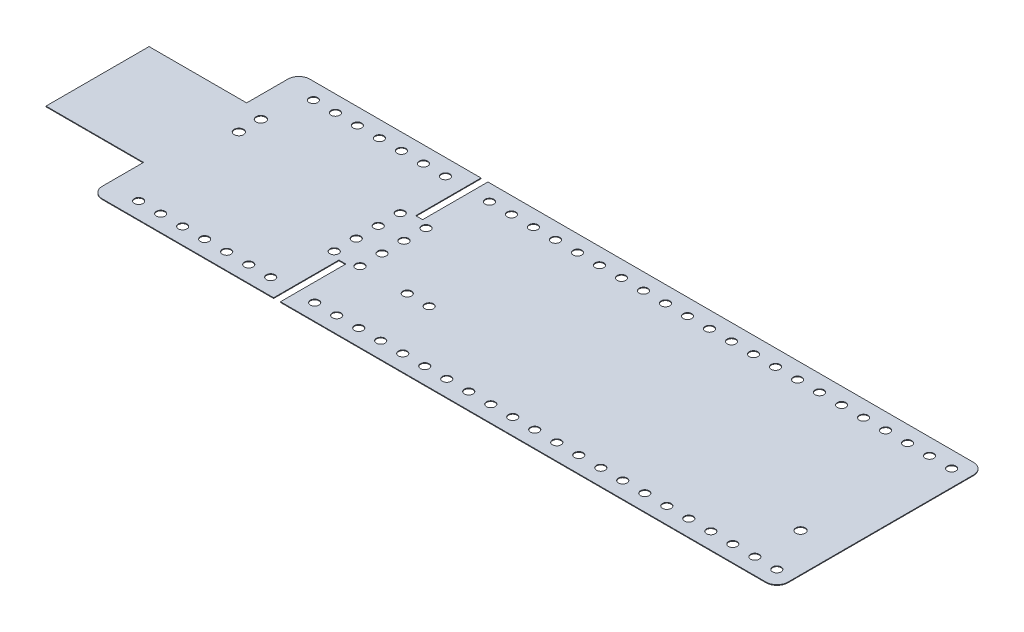
from build123d import *

# Parameters (mm, degrees)
BOSS_EXTRUDE1_DEPTH = 0.03935
SKETCH2_R           = 0.5
CUT_EXTRUDE1_DEPTH  = 92.905399834
SKETCH3_R           = 0.5
CUT_EXTRUDE2_DEPTH  = 92.905399834
SKETCH4_R           = 0.5
CUT_EXTRUDE3_DEPTH  = 92.905399834
SKETCH5_W           = 0.8
SKETCH5_H           = 7.6
CUT_EXTRUDE4_DEPTH  = 92.905399834
SKETCH6_R           = 0.5461
CUT_EXTRUDE5_DEPTH  = 92.905399834
SKETCH7_R           = 0.5461
CUT_EXTRUDE6_DEPTH  = 92.905399834
FILLET1_R           = 1.27


with BuildPart() as part:
    # Sketch1 → Boss-Extrude1 (new, symmetric)
    with BuildSketch(Plane(origin=(0, 0, 0), x_dir=(1, 0, 0), z_dir=(0, 1, 0))):
        Polygon((91.11, -12.065), (11.35, -12.065), (11.35, -5.995), (0, -5.995), (0, 5.995), (11.35, 5.995), (11.35, 12.065), (91.11, 12.065), align=None)
    extrude(amount=BOSS_EXTRUDE1_DEPTH, both=True)

    # Sketch2 → Cut-Extrude1 (cut, through all)
    with BuildSketch(Plane(origin=(0, 0.03935, 0), x_dir=(1, 0, 0), z_dir=(0, 1, 0))):
        with Locations(Location((14.95, 10.165, 0), (0, 0, 270))):
            Circle(SKETCH2_R)
        with Locations(Location((17.51, 10.165, 0), (0, 0, 270))):
            Circle(SKETCH2_R)
        with Locations(Location((20.07, 10.165, 0), (0, 0, 270))):
            Circle(SKETCH2_R)
        with Locations(Location((22.63, 10.165, 0), (0, 0, 270))):
            Circle(SKETCH2_R)
        with Locations(Location((25.19, 10.165, 0), (0, 0, 270))):
            Circle(SKETCH2_R)
        with Locations(Location((27.75, 10.165, 0), (0, 0, 270))):
            Circle(SKETCH2_R)
        with Locations(Location((30.31, 10.165, 0), (0, 0, 270))):
            Circle(SKETCH2_R)
        with Locations(Location((35.43, 10.165, 0), (0, 0, 270))):
            Circle(SKETCH2_R)
        with Locations(Location((37.99, 10.165, 0), (0, 0, 270))):
            Circle(SKETCH2_R)
        with Locations(Location((40.55, 10.165, 0), (0, 0, 270))):
            Circle(SKETCH2_R)
        with Locations(Location((43.11, 10.165, 0), (0, 0, 270))):
            Circle(SKETCH2_R)
        with Locations(Location((45.67, 10.165, 0), (0, 0, 270))):
            Circle(SKETCH2_R)
        with Locations(Location((48.23, 10.165, 0), (0, 0, 270))):
            Circle(SKETCH2_R)
        with Locations(Location((50.79, 10.165, 0), (0, 0, 270))):
            Circle(SKETCH2_R)
        with Locations(Location((53.35, 10.165, 0), (0, 0, 270))):
            Circle(SKETCH2_R)
        with Locations(Location((55.91, 10.165, 0), (0, 0, 270))):
            Circle(SKETCH2_R)
        with Locations(Location((58.47, 10.165, 0), (0, 0, 270))):
            Circle(SKETCH2_R)
        with Locations(Location((61.03, 10.165, 0), (0, 0, 270))):
            Circle(SKETCH2_R)
        with Locations(Location((63.59, 10.165, 0), (0, 0, 270))):
            Circle(SKETCH2_R)
        with Locations(Location((66.15, 10.165, 0), (0, 0, 270))):
            Circle(SKETCH2_R)
        with Locations(Location((68.71, 10.165, 0), (0, 0, 270))):
            Circle(SKETCH2_R)
        with Locations(Location((71.27, 10.165, 0), (0, 0, 270))):
            Circle(SKETCH2_R)
        with Locations(Location((73.83, 10.165, 0), (0, 0, 270))):
            Circle(SKETCH2_R)
        with Locations(Location((76.39, 10.165, 0), (0, 0, 270))):
            Circle(SKETCH2_R)
        with Locations(Location((78.95, 10.165, 0), (0, 0, 270))):
            Circle(SKETCH2_R)
        with Locations(Location((81.51, 10.165, 0), (0, 0, 270))):
            Circle(SKETCH2_R)
        with Locations(Location((84.07, 10.165, 0), (0, 0, 270))):
            Circle(SKETCH2_R)
        with Locations(Location((86.63, 10.165, 0), (0, 0, 270))):
            Circle(SKETCH2_R)
        with Locations(Location((89.19, 10.165, 0), (0, 0, 270))):
            Circle(SKETCH2_R)
    cut_extrude1 = extrude(amount=-CUT_EXTRUDE1_DEPTH, mode=Mode.SUBTRACT)

    # Mirror1: Cut-Extrude1 across plane
    add(cut_extrude1.mirror(Plane.XY), mode=Mode.SUBTRACT)

    # Sketch3 → Cut-Extrude2 (cut, through all)
    with BuildSketch(Plane(origin=(0, 0.03935, 0), x_dir=(1, 0, 0), z_dir=(0, 1, 0))):
        with Locations(Location((31.396543447, 3.82006498, 0), (0, 0, 270))):
            Circle(SKETCH3_R)
        with Locations(Location((34.396543447, 3.82006498, 0), (0, 0, 270))):
            Circle(SKETCH3_R)
        with Locations(Location((34.396543447, 1.26006498, 0), (0, 0, 270))):
            Circle(SKETCH3_R)
        with Locations(Location((34.396543447, -1.29993502, 0), (0, 0, 270))):
            Circle(SKETCH3_R)
        with Locations(Location((34.396543447, -3.85993502, 0), (0, 0, 270))):
            Circle(SKETCH3_R)
        with Locations(Location((31.396543447, 1.26006498, 0), (0, 0, 270))):
            Circle(SKETCH3_R)
        with Locations(Location((31.396543447, -1.29993502, 0), (0, 0, 270))):
            Circle(SKETCH3_R)
        with Locations(Location((31.396543447, -3.85993502, 0), (0, 0, 270))):
            Circle(SKETCH3_R)
    extrude(amount=-CUT_EXTRUDE2_DEPTH, mode=Mode.SUBTRACT)

    # Sketch4 → Cut-Extrude3 (cut, through all)
    with BuildSketch(Plane(origin=(0, 0.03935, 0), x_dir=(1, 0, 0), z_dir=(0, 1, 0))):
        with Locations(Location((39.896471903, -3.871334333, 0), (0, 0, 270))):
            Circle(SKETCH4_R)
        with Locations(Location((42.456471903, -3.871334333, 0), (0, 0, 270))):
            Circle(SKETCH4_R)
    extrude(amount=-CUT_EXTRUDE3_DEPTH, mode=Mode.SUBTRACT)

    # Sketch5 → Cut-Extrude4 (cut, through all)
    with BuildSketch(Plane(origin=(0, 0.03935, 0), x_dir=(1, 0, 0), z_dir=(0, 1, 0))):
        with Locations((32.95, 8.265)):
            Rectangle(SKETCH5_W, SKETCH5_H)
    cut_extrude4 = extrude(amount=-CUT_EXTRUDE4_DEPTH, mode=Mode.SUBTRACT)

    # Mirror2: Cut-Extrude4 across plane
    add(cut_extrude4.mirror(Plane.XY), mode=Mode.SUBTRACT)

    # Sketch6 → Cut-Extrude5 (cut, through all)
    with BuildSketch(Plane(origin=(0, 0.03935, 0), x_dir=(1, 0, 0), z_dir=(0, 1, 0))):
        with Locations(Location((13.827489542, 5.174256262, 0), (0, 0, 270))):
            Circle(SKETCH6_R)
        with Locations(Location((13.827489542, 2.614256262, 0), (0, 0, 270))):
            Circle(SKETCH6_R)
    extrude(amount=-CUT_EXTRUDE5_DEPTH, mode=Mode.SUBTRACT)

    # Sketch7 → Cut-Extrude6 (cut, through all)
    with BuildSketch(Plane(origin=(0, 0.03935, 0), x_dir=(1, 0, 0), z_dir=(0, 1, 0))):
        with Locations(Location((86.654615346, -4.866346519, 0), (0, 0, 270))):
            Circle(SKETCH7_R)
    extrude(amount=-CUT_EXTRUDE6_DEPTH, mode=Mode.SUBTRACT)

    # Fillet1
    fillet1_edges = [part.edges().sort_by_distance(p)[0] for p in [
        (11.35, 0, -12.065),
        (91.11, 0, -12.065),
        (91.11, 0, 12.065),
        (11.35, 0, 12.065),
    ]]
    fillet(fillet1_edges, radius=FILLET1_R)


solid = part.part
